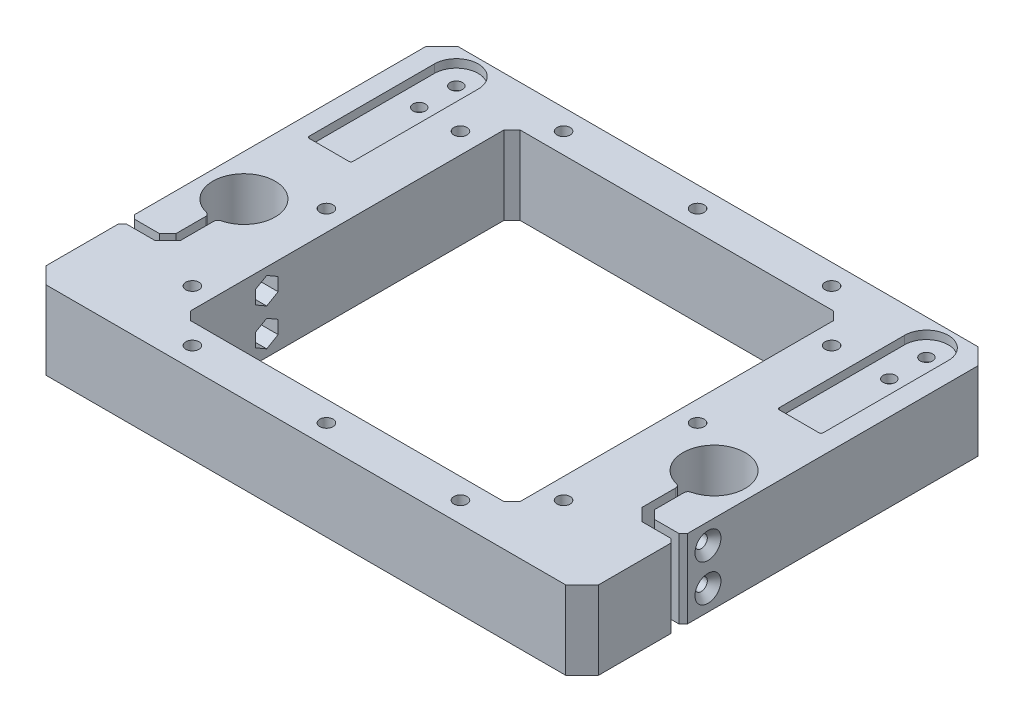
from build123d import *
from build123d.topology import SkipClean

# Parameters (mm, degrees)
SKETCH1_R                                       = 1.6
BOSS_EXTRUDE2_DEPTH                             = 19
SKETCH3_W                                       = 80
SKETCH3_H                                       = 80
CUT_EXTRUDE2_DEPTH                              = 74.218850032
CHAMFER1_SIZE                                   = 2
BOSS_EXTRUDE3_DEPTH                             = 19
SKETCH5_R                                       = 1.5
SKETCH5_R_2                                     = 7.55
CUT_EXTRUDE3_DEPTH                              = 86.732140997
CUT_EXTRUDE1_DEPTH                              = 15
CUT_EXTRUDE4_DEPTH                              = 86.732140997
CUT_EXTRUDE4_DEPTH_BACK                         = 86.732140997
BOSS_EXTRUDE4_START                             = -19
BOSS_EXTRUDE4_DEPTH                             = 19
CUT_EXTRUDE5_DEPTH                              = 129.646803303
CUT_EXTRUDE5_DEPTH_BACK                         = 129.646803303
SKETCH8_R                                       = 1.5
CUT_EXTRUDE6_DEPTH                              = 14
CSK_FOR_M3_FLAT_HEAD_MACHINE_SCREW1_D           = 3
CSK_FOR_M3_FLAT_HEAD_MACHINE_SCREW1_DEPTH       = 27
CSK_FOR_M3_FLAT_HEAD_MACHINE_SCREW1_CSINK_D     = 6.3
CSK_FOR_M3_FLAT_HEAD_MACHINE_SCREW1_CSINK_ANGLE = 90
CSK_FOR_M3_FLAT_HEAD_MACHINE_SCREW1_TIP         = 0.901290929
BOSS_EXTRUDE5_DEPTH                             = 19
CHAMFER2_SIZE                                   = 2
CHAMFER3_SIZE                                   = 3
FILLET3_R                                       = 1
CHAMFER4_SIZE                                   = 1
CUT_EXTRUDE7_DEPTH                              = 2
FILLET2_R                                       = 0.5
CSK_FOR_M6_FLAT_HEAD_MACHINE_SCREW1_D           = 6
CSK_FOR_M6_FLAT_HEAD_MACHINE_SCREW1_DEPTH       = 14
CSK_FOR_M6_FLAT_HEAD_MACHINE_SCREW1_CSINK_D     = 12.6
CSK_FOR_M6_FLAT_HEAD_MACHINE_SCREW1_CSINK_ANGLE = 90
CSK_FOR_M6_FLAT_HEAD_MACHINE_SCREW1_TIP         = 1.802581857
CUT_EXTRUDE8_DEPTH                              = 122.86057607
CUT_EXTRUDE8_DEPTH_BACK                         = 122.86057607
SKETCH11_W                                      = 50
SKETCH11_H                                      = 19
BOSS_EXTRUDE6_DEPTH                             = 5


with BuildPart() as part:
    # Sketch1 → Boss-Extrude2 (new body)
    with BuildSketch(Plane(origin=(0, 0, 0), x_dir=(1, 0, 0), z_dir=(0, 1, 0))):
        Polygon((-50, 46), (-50, -46), (-46, -50), (46, -50), (50, -46), (50, 46), (46, 50), (-46, 50), align=None)
        with Locations(Location((-45, 0, 0), (0, 0, 270))):
            Circle(SKETCH1_R, mode=Mode.SUBTRACT)
        with Locations(Location((-45, -32.5, 0), (0, 0, 270))):
            Circle(SKETCH1_R, mode=Mode.SUBTRACT)
        with Locations(Location((-32.5, -45, 0), (0, 0, 270))):
            Circle(SKETCH1_R, mode=Mode.SUBTRACT)
        with Locations(Location((0, -45, 0), (0, 0, 270))):
            Circle(SKETCH1_R, mode=Mode.SUBTRACT)
        with Locations(Location((32.5, -45, 0), (0, 0, 270))):
            Circle(SKETCH1_R, mode=Mode.SUBTRACT)
        with Locations(Location((45, -32.5, 0), (0, 0, 270))):
            Circle(SKETCH1_R, mode=Mode.SUBTRACT)
        with Locations(Location((45, 0, 0), (0, 0, 270))):
            Circle(SKETCH1_R, mode=Mode.SUBTRACT)
        with Locations(Location((45, 32.5, 0), (0, 0, 270))):
            Circle(SKETCH1_R, mode=Mode.SUBTRACT)
        with Locations(Location((32.5, 45, 0), (0, 0, 270))):
            Circle(SKETCH1_R, mode=Mode.SUBTRACT)
        with Locations(Location((0, 45, 0), (0, 0, 270))):
            Circle(SKETCH1_R, mode=Mode.SUBTRACT)
        with Locations(Location((-32.5, 45, 0), (0, 0, 270))):
            Circle(SKETCH1_R, mode=Mode.SUBTRACT)
        with Locations(Location((-45, 32.5, 0), (0, 0, 270))):
            Circle(SKETCH1_R, mode=Mode.SUBTRACT)
    extrude(amount=-BOSS_EXTRUDE2_DEPTH)

    # Sketch3 → Cut-Extrude2 (cut, through all)
    with BuildSketch(Plane(origin=(0, -19, 0), x_dir=(1, 0, 0), z_dir=(0, 1, 0))):
        Rectangle(SKETCH3_W, SKETCH3_H)
    extrude(amount=CUT_EXTRUDE2_DEPTH, mode=Mode.SUBTRACT)

    # Chamfer1
    chamfer1_edges = [part.edges().sort_by_distance(p)[0] for p in [
        (40, -9.5, 40),
        (40, -9.5, -40),
        (-40, -9.5, -40),
        (-40, -9.5, 40),
    ]]
    chamfer(chamfer1_edges, length=CHAMFER1_SIZE)

    # Sketch4 → Boss-Extrude3 (add)
    with BuildSketch(Plane(origin=(0, 0, 0), x_dir=(1, 0, 0), z_dir=(0, 1, 0))):
        Polygon((67, 46), (67, -46), (63, -50), (46, -50), (50, -46), (50, 46), (46, 50), (63, 50), align=None)
    extrude(amount=-BOSS_EXTRUDE3_DEPTH)

    # Sketch5 → Cut-Extrude3 (cut, through all)
    with BuildSketch(Plane.XZ.offset(19)):
        with Locations(Location((57, -43.5, 0), (0, 0, 270))):
            Circle(SKETCH5_R)
        with Locations(Location((57, -34.5, 0), (0, 0, 270))):
            Circle(SKETCH5_R)
        with Locations(Location((57, 8, 0), (0, 0, 270))):
            Circle(SKETCH5_R_2)
    extrude(amount=-CUT_EXTRUDE3_DEPTH, mode=Mode.SUBTRACT)

    # Sketch2 → Cut-Extrude1 (cut)
    with BuildSketch(Plane(origin=(0, -19, 0), x_dir=(1, 0, 0), z_dir=(0, 1, 0))):
        Polygon((-29.295706006, 45), (-30.897853003, 47.775), (-34.102146997, 47.775), (-35.704293994, 45), (-34.102146997, 42.225), (-30.897853003, 42.225), align=None)
        Polygon((3.204293994, 45), (1.602146997, 47.775), (-1.602146997, 47.775), (-3.204293994, 45), (-1.602146997, 42.225), (1.602146997, 42.225), align=None)
        Polygon((35.704293994, 45), (34.102146997, 47.775), (30.897853003, 47.775), (29.295706006, 45), (30.897853003, 42.225), (34.102146997, 42.225), align=None)
        Polygon((45, 35.704293994), (42.225, 34.102146997), (42.225, 30.897853003), (45, 29.295706006), (47.775, 30.897853003), (47.775, 34.102146997), align=None)
        Polygon((45, 3.204293994), (42.225, 1.602146997), (42.225, -1.602146997), (45, -3.204293994), (47.775, -1.602146997), (47.775, 1.602146997), align=None)
        Polygon((45, -29.295706006), (42.225, -30.897853003), (42.225, -34.102146997), (45, -35.704293994), (47.775, -34.102146997), (47.775, -30.897853003), align=None)
        Polygon((30.897853003, -42.225), (29.295706006, -45), (30.897853003, -47.775), (34.102146997, -47.775), (35.704293994, -45), (34.102146997, -42.225), align=None)
        Polygon((-1.602146997, -42.225), (-3.204293994, -45), (-1.602146997, -47.775), (1.602146997, -47.775), (3.204293994, -45), (1.602146997, -42.225), align=None)
        Polygon((-34.102146997, -42.225), (-35.704293994, -45), (-34.102146997, -47.775), (-30.897853003, -47.775), (-29.295706006, -45), (-30.897853003, -42.225), align=None)
        Polygon((-42.225, -30.897853003), (-45, -29.295706006), (-47.775, -30.897853003), (-47.775, -34.102146997), (-45, -35.704293994), (-42.225, -34.102146997), align=None)
        Polygon((-45, 3.204293994), (-47.775, 1.602146997), (-47.775, -1.602146997), (-45, -3.204293994), (-42.225, -1.602146997), (-42.225, 1.602146997), align=None)
        Polygon((-42.225, 34.102146997), (-45, 35.704293994), (-47.775, 34.102146997), (-47.775, 30.897853003), (-45, 29.295706006), (-42.225, 30.897853003), align=None)
        Polygon((59.775, 45.102146997), (57, 46.704293994), (54.225, 45.102146997), (54.225, 41.897853003), (57, 40.295706006), (59.775, 41.897853003), align=None)
        Polygon((59.775, 36.102146997), (57, 37.704293994), (54.225, 36.102146997), (54.225, 32.897853003), (57, 31.295706006), (59.775, 32.897853003), align=None)
    extrude(amount=CUT_EXTRUDE1_DEPTH, mode=Mode.SUBTRACT)

    # Sketch6 → Cut-Extrude4 (cut, two sides: drawn at the far end of the back side and taken through both)
    with BuildSketch(Plane.XZ.offset(19).offset(-CUT_EXTRUDE4_DEPTH_BACK)):
        with BuildLine():
            Line((56, 17.949874371), (56, 46))
            Line((56, 46), (52, 50))
            Line((52, 50), (63, 50))
            Line((63, 50), (67, 46))
            Line((67, 46), (67, 8))
            ThreePointArc((67, 8), (64.416198487, 14.708203932), (58, 17.949874371))
            Line((58, 17.949874371), (58, 15.48348181))
            Line((58, 15.48348181), (56, 15.48348181))
            Line((56, 15.48348181), (56, 17.949874371))
        make_face()
    extrude(amount=CUT_EXTRUDE4_DEPTH + CUT_EXTRUDE4_DEPTH_BACK, mode=Mode.SUBTRACT)

    # Sketch7 → Boss-Extrude4 (add)
    with BuildSketch(Plane.XZ.offset(19).offset(BOSS_EXTRUDE4_START)):
        with BuildLine():
            Line((67, 25.48348181), (67, 8))
            ThreePointArc((67, 8), (64.416198487, 14.708203932), (58, 17.949874371))
            Line((58, 17.949874371), (58, 25.48348181))
            Line((58, 25.48348181), (67, 25.48348181))
        make_face()
    extrude(amount=BOSS_EXTRUDE4_DEPTH)

    # Sketch8 → Cut-Extrude5 (cut, two sides: drawn at the far end of the back side and taken through both)
    with BuildSketch(Plane(origin=(67, 0, 0), x_dir=(0, 0, -1), z_dir=(1, 0, 0)).offset(-CUT_EXTRUDE5_DEPTH_BACK)):
        with Locations((-19.48348181, -5)):
            Circle(SKETCH8_R)
        with Locations((-19.48348181, -14)):
            Circle(SKETCH8_R)
    extrude(amount=CUT_EXTRUDE5_DEPTH + CUT_EXTRUDE5_DEPTH_BACK, mode=Mode.SUBTRACT)

    # Sketch9 → Cut-Extrude6 (cut)
    with BuildSketch(Plane.ZY.offset(-40)):
        Polygon((22.25848181, -3.397853003), (19.48348181, -1.795706006), (16.70848181, -3.397853003), (16.70848181, -6.602146997), (19.48348181, -8.204293994), (22.25848181, -6.602146997), align=None)
        Polygon((22.25848181, -12.397853003), (19.48348181, -10.795706006), (16.70848181, -12.397853003), (16.70848181, -15.602146997), (19.48348181, -17.204293994), (22.25848181, -15.602146997), align=None)
    extrude(amount=-CUT_EXTRUDE6_DEPTH, mode=Mode.SUBTRACT)

    # CSK for M3 Flat Head Machine Screw1
    with Locations(Plane(origin=(67, 0, 0), x_dir=(0, 0, -1), z_dir=(1, 0, 0))):
        with Locations((-19.48348181, -5), (-19.48348181, -14)):
            CounterSinkHole(CSK_FOR_M3_FLAT_HEAD_MACHINE_SCREW1_D / 2, CSK_FOR_M3_FLAT_HEAD_MACHINE_SCREW1_CSINK_D / 2, depth=CSK_FOR_M3_FLAT_HEAD_MACHINE_SCREW1_DEPTH, counter_sink_angle=CSK_FOR_M3_FLAT_HEAD_MACHINE_SCREW1_CSINK_ANGLE)
            with Locations((0, 0, -(CSK_FOR_M3_FLAT_HEAD_MACHINE_SCREW1_DEPTH + CSK_FOR_M3_FLAT_HEAD_MACHINE_SCREW1_TIP / 2))):  # 118° drill point
                Cone(0, CSK_FOR_M3_FLAT_HEAD_MACHINE_SCREW1_D / 2, CSK_FOR_M3_FLAT_HEAD_MACHINE_SCREW1_TIP, mode=Mode.SUBTRACT)

    # Sketch14 → Boss-Extrude5 (add)
    with BuildSketch(Plane.XZ.offset(19)):
        Polygon((52, 50), (56, 46), (56, 27.48348181), (67, 27.48348181), (67, 46), (63, 50), align=None)
    extrude(amount=-BOSS_EXTRUDE5_DEPTH)

    # Chamfer2
    chamfer2_edges = [part.edges().sort_by_distance(p)[0] for p in [
        (58, -9.5, 25.48348181),
    ]]
    chamfer(chamfer2_edges, length=CHAMFER2_SIZE)

    # Chamfer3
    chamfer3_edges = [part.edges().sort_by_distance(p)[0] for p in [
        (56, -9.5, 27.48348181),
    ]]
    chamfer(chamfer3_edges, length=CHAMFER3_SIZE)

    # Fillet3
    fillet3_edges = [part.edges().sort_by_distance(p)[0] for p in [
        (56, -9.5, 15.48348181),
        (58, -9.5, 15.48348181),
    ]]
    fillet(fillet3_edges, radius=FILLET3_R)

    # Chamfer4
    chamfer4_edges = [part.edges().sort_by_distance(p)[0] for p in [
        (67, -9.5, 25.48348181),
        (67, -9.5, 27.48348181),
    ]]
    chamfer(chamfer4_edges, length=CHAMFER4_SIZE)

    # Sketch10 → Cut-Extrude7 (cut)
    with BuildSketch(Plane(origin=(0, 0, 0), x_dir=(1, 0, 0), z_dir=(0, 1, 0))):
        with BuildLine():
            Line((51.7, 12.65), (51.7, 43.5))
            ThreePointArc((51.7, 43.5), (57, 48.8), (62.3, 43.5))
            Line((62.3, 43.5), (62.3, 12.65))
            Line((62.3, 12.65), (51.7, 12.65))
        make_face()
    extrude(amount=-CUT_EXTRUDE7_DEPTH, mode=Mode.SUBTRACT)

    # Fillet2
    fillet2_edges = [part.edges().sort_by_distance(p)[0] for p in [
        (62.3, -1, -12.65),
        (51.7, -1, -12.65),
    ]]
    fillet(fillet2_edges, radius=FILLET2_R)

    # CSK for M6 Flat Head Machine Screw1
    with Locations(Plane(origin=(0, -19, 0), x_dir=(-1, 0, 0), z_dir=(0, -1, 0))):
        with Locations((-57, 9.55)):
            CounterSinkHole(CSK_FOR_M6_FLAT_HEAD_MACHINE_SCREW1_D / 2, CSK_FOR_M6_FLAT_HEAD_MACHINE_SCREW1_CSINK_D / 2, depth=CSK_FOR_M6_FLAT_HEAD_MACHINE_SCREW1_DEPTH, counter_sink_angle=CSK_FOR_M6_FLAT_HEAD_MACHINE_SCREW1_CSINK_ANGLE)
            with Locations((0, 0, -(CSK_FOR_M6_FLAT_HEAD_MACHINE_SCREW1_DEPTH + CSK_FOR_M6_FLAT_HEAD_MACHINE_SCREW1_TIP / 2))):  # 118° drill point
                Cone(0, CSK_FOR_M6_FLAT_HEAD_MACHINE_SCREW1_D / 2, CSK_FOR_M6_FLAT_HEAD_MACHINE_SCREW1_TIP, mode=Mode.SUBTRACT)

    # Sketch11 → Cut-Extrude8 (cut, two sides: drawn at the far end of the back side and taken through both)
    with BuildSketch(Plane(origin=(0, 0, -50), x_dir=(-1, 0, 0), z_dir=(0, 0, -1)).offset(-CUT_EXTRUDE8_DEPTH_BACK)):
        with Locations((25, -9.5)):
            Rectangle(SKETCH11_W, SKETCH11_H)
    extrude(amount=CUT_EXTRUDE8_DEPTH + CUT_EXTRUDE8_DEPTH_BACK, mode=Mode.SUBTRACT)

    # Mirror1: part across plane


with BuildPart() as part_1:
    with SkipClean():  # the faces are left unmerged after this step: merging them gives an invalid solid
        add(part.part)
        add(part.part.mirror(Plane(origin=(0, 0, 50), x_dir=(0, 0, 1), z_dir=(1, 0, 0))))


with BuildPart() as body_2:
    # Sketch17 → Boss-Extrude6 (new body)
    with BuildSketch(Plane.XZ.offset(19)):
        Polygon((-42.425, 31.013323057), (-42.425, 33.986676943), (-45, 35.473353886), (-47.575, 33.986676943), (-47.575, 31.013323057), (-45, 29.526646114), align=None)
    extrude(amount=-BOSS_EXTRUDE6_DEPTH)


solid = Compound([part_1.part, body_2.part])
